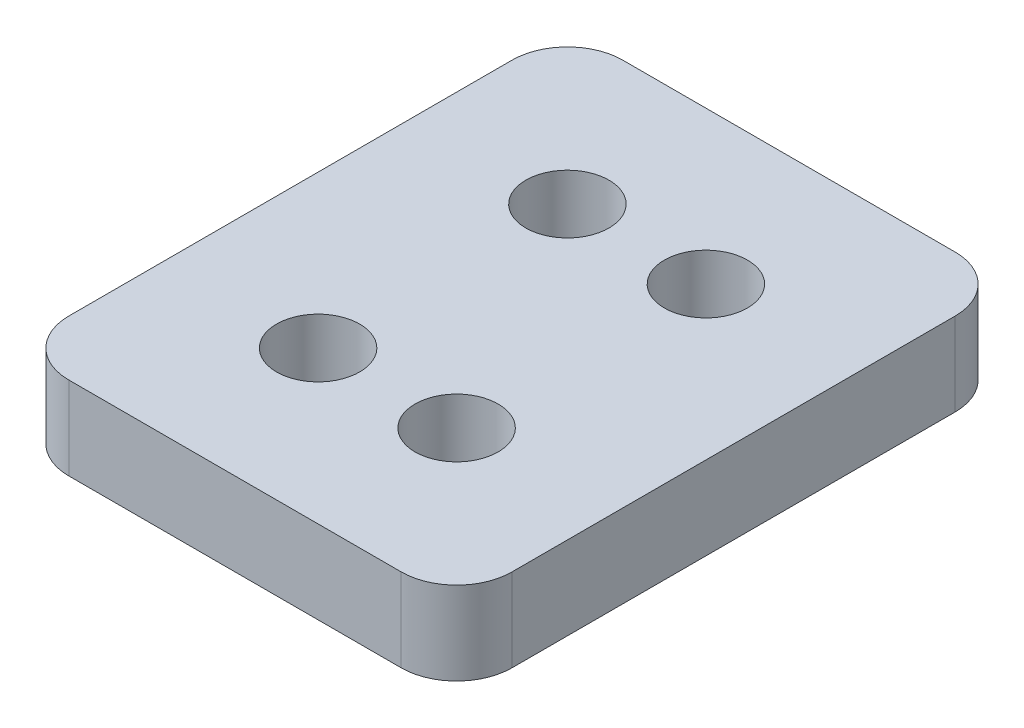
from build123d import *

# Parameters (mm, degrees)
SKETCH1_W           = 16
SKETCH1_H           = 20
BOSS_EXTRUDE1_DEPTH = 1.5
SKETCH2_R           = 1.5
CUT_EXTRUDE1_DEPTH  = 3
FILLET1_R           = 2


with BuildPart() as part:
    # Sketch1 → Boss-Extrude1 (new, symmetric)
    with BuildSketch(Plane(origin=(0, 0, 0), x_dir=(1, 0, 0), z_dir=(0, 1, 0))):
        Rectangle(SKETCH1_W, SKETCH1_H)
    extrude(amount=BOSS_EXTRUDE1_DEPTH, both=True)

    # Sketch2 → Cut-Extrude1 (cut)
    with BuildSketch(Plane(origin=(0, 1.5, 0), x_dir=(1, 0, 0), z_dir=(0, 1, 0))):
        with Locations(Location((-2.5, -4.5, 0), (0, 0, 270))):
            Circle(SKETCH2_R)
        with Locations(Location((-2.5, 4.5, 0), (0, 0, 270))):
            Circle(SKETCH2_R)
        with Locations(Location((2.5, 4.5, 0), (0, 0, 270))):
            Circle(SKETCH2_R)
        with Locations(Location((2.5, -4.5, 0), (0, 0, 270))):
            Circle(SKETCH2_R)
    extrude(amount=-CUT_EXTRUDE1_DEPTH, mode=Mode.SUBTRACT)

    # Fillet1
    fillet1_edges = [part.edges().sort_by_distance(p)[0] for p in [
        (8, 0, 10),
        (-8, 0, 10),
        (-8, 0, -10),
        (8, 0, -10),
    ]]
    fillet(fillet1_edges, radius=FILLET1_R)


solid = part.part
